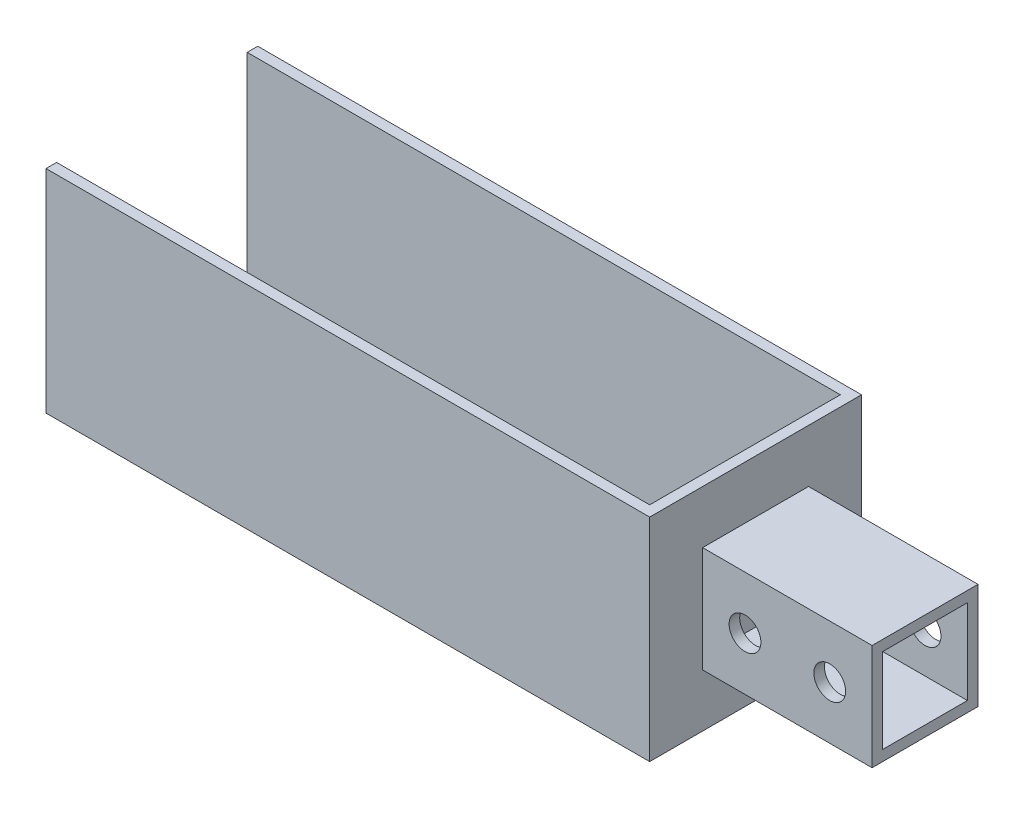
from build123d import *

# Parameters (mm, degrees)
SKETCH1_W                       = 31.75
SKETCH1_H                       = 31.75
SKETCH1_W_2                     = 25.4
SKETCH1_H_2                     = 25.4
BOSS_EXTRUDE1_DEPTH             = 50.8
SKETCH2_W                       = 63.5
SKETCH2_H                       = 63.5
BOSS_EXTRUDE2_DEPTH             = 3.175
F_97_0_375_DIAMETER_HOLE1_D     = 9.525
F_97_0_375_DIAMETER_HOLE1_DEPTH = 76.2
BOSS_EXTRUDE3_DEPTH             = 177.8


with BuildPart() as part:
    # Sketch1 → Boss-Extrude1 (new body)
    with BuildSketch(Plane.YZ):
        with Locations((-2.823153034, -6.41701847)):
            Rectangle(SKETCH1_W, SKETCH1_H)
        with Locations((-2.823153034, -6.41701847)):
            Rectangle(SKETCH1_W_2, SKETCH1_H_2, mode=Mode.SUBTRACT)
    extrude(amount=BOSS_EXTRUDE1_DEPTH)

    # Sketch2 → Boss-Extrude2 (add)
    with BuildSketch(Plane(origin=(0, 0, 0), x_dir=(0, -1, 0), z_dir=(-1, 0, 0))):
        with Locations((2.823153034, -6.41701847)):
            Rectangle(SKETCH2_W, SKETCH2_H)
    extrude(amount=BOSS_EXTRUDE2_DEPTH)

    # #97 (0.375) Diameter Hole1
    with Locations(Plane.XY.offset(9.45798153)):
        with Locations((38.1, -2.823153034), (12.7, -2.823153034)):
            Hole(F_97_0_375_DIAMETER_HOLE1_D / 2, depth=F_97_0_375_DIAMETER_HOLE1_DEPTH)

    # Sketch7 → Boss-Extrude3 (add)
    with BuildSketch(Plane.ZY.offset(3.175)):
        Polygon((-38.16701847, 28.926846966), (-34.99201847, 28.926846966), (-34.99201847, -31.398153034), (22.15798153, -31.398153034), (22.15798153, 28.926846966), (25.33298153, 28.926846966), (25.33298153, -34.573153034), (-38.16701847, -34.573153034), align=None)
    extrude(amount=BOSS_EXTRUDE3_DEPTH)


solid = part.part
